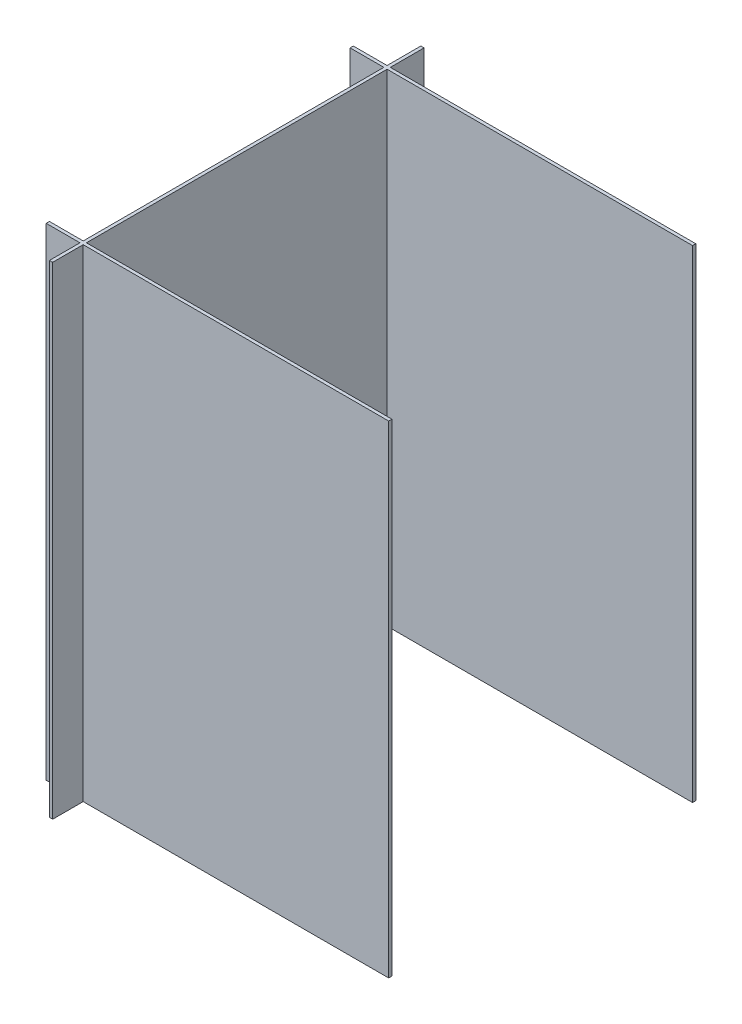
from build123d import *

# Parameters (mm, degrees)
BOSS_EXTRUDE1_DEPTH = 300


with BuildPart() as part:
    # Sketch1 → Boss-Extrude1 (new body)
    with BuildSketch(Plane(origin=(0, 0, 0), x_dir=(1, 0, 0), z_dir=(0, 1, 0))):
        Polygon((-56.161611152, -42.302266887), (-35.161611152, -42.302266887), (-35.161611152, -21.302266887), (-33.161611152, -21.302266887), (-33.161611152, -42.302266887), (156.838388848, -42.302266887), (156.838388848, -44.302266887), (-33.161611152, -44.302266887), (-33.161611152, -231.302266887), (156.838388848, -231.302266887), (156.838388848, -233.302266887), (-33.161611152, -233.302266887), (-33.161611152, -252.302266887), (-35.161611152, -252.302266887), (-35.161611152, -233.302266887), (-56.161611152, -233.302266887), (-56.161611152, -231.302266887), (-35.161611152, -231.302266887), (-35.161611152, -44.302266887), (-56.161611152, -44.302266887), align=None)
    extrude(amount=BOSS_EXTRUDE1_DEPTH)


solid = part.part
